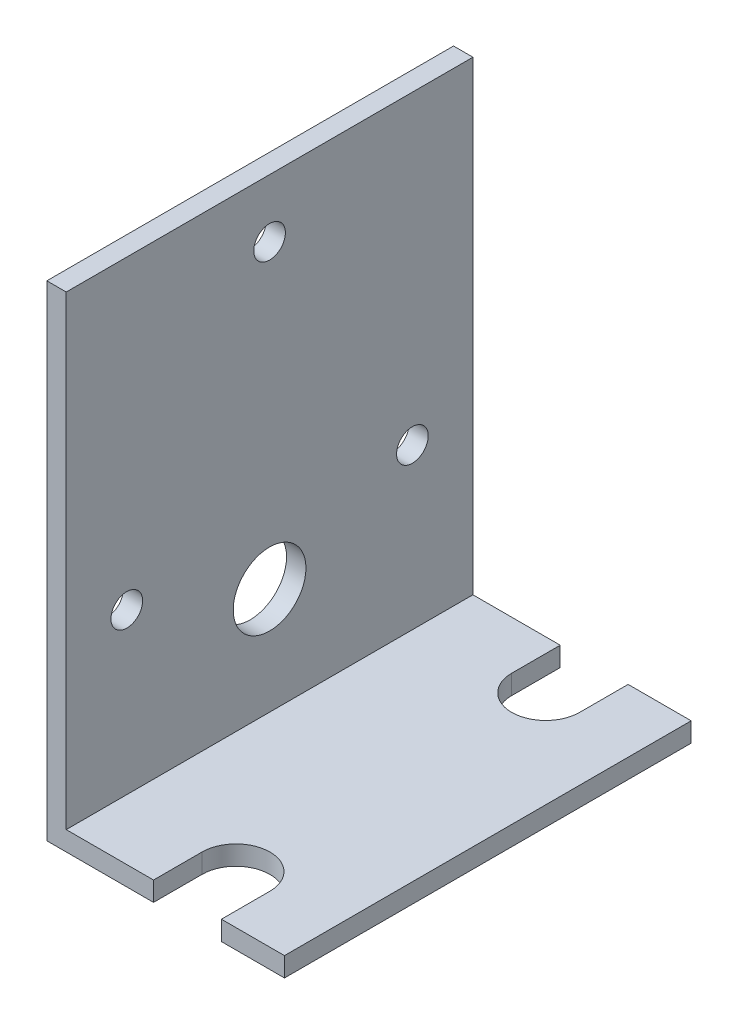
from build123d import *

# Parameters (mm, degrees)
BOSS_EXTRUDE1_DEPTH      = 20.965
BOSS_EXTRUDE1_DEPTH_BACK = 20.965
F_4_CLEARANCE_HOLE1_D    = 3.2639
CUT_EXTRUDE1_DEPTH       = 2
SKETCH7_R                = 3.75
CUT_EXTRUDE2_DEPTH       = 2


with BuildPart() as part:
    # Sketch1 → Boss-Extrude1 (new, two sides: drawn at the far end of the back side and taken through both)
    with BuildSketch(Plane.XY.offset(-BOSS_EXTRUDE1_DEPTH_BACK)):
        Polygon((0, 50), (0, 0), (24.5, 0), (24.5, 2), (2, 2), (2, 50), align=None)
    extrude(amount=BOSS_EXTRUDE1_DEPTH + BOSS_EXTRUDE1_DEPTH_BACK)

    # #4 Clearance Hole1 (through all)
    with Locations(Plane(origin=(2, 0, 0), x_dir=(0, 0, -1), z_dir=(1, 0, 0))):
        with Locations((0, 44), (-14.722431864, 18.5), (14.722431864, 18.5)):
            Hole(F_4_CLEARANCE_HOLE1_D / 2)

    # Sketch6 → Cut-Extrude1 (cut)
    with BuildSketch(Plane(origin=(0, 2, 0), x_dir=(1, 0, 0), z_dir=(0, 1, 0))):
        with BuildLine():
            Line((11, -20.965), (11, -15.965))
            ThreePointArc((11, -15.965), (14.5, -12.465), (18, -15.965))
            Line((18, -15.965), (18, -20.965))
            ThreePointArc((18, -20.965), (14.5, -24.465), (11, -20.965))
        make_face()
    cut_extrude1 = extrude(amount=-CUT_EXTRUDE1_DEPTH, mode=Mode.SUBTRACT)

    # Mirror1: Cut-Extrude1 across plane
    add(cut_extrude1.mirror(Plane.XY), mode=Mode.SUBTRACT)

    # Sketch7 → Cut-Extrude2 (cut)
    with BuildSketch(Plane(origin=(2, 0, 0), x_dir=(0, 0, -1), z_dir=(1, 0, 0))):
        with Locations((0, 13)):
            Circle(SKETCH7_R)
    extrude(amount=-CUT_EXTRUDE2_DEPTH, mode=Mode.SUBTRACT)


solid = part.part
